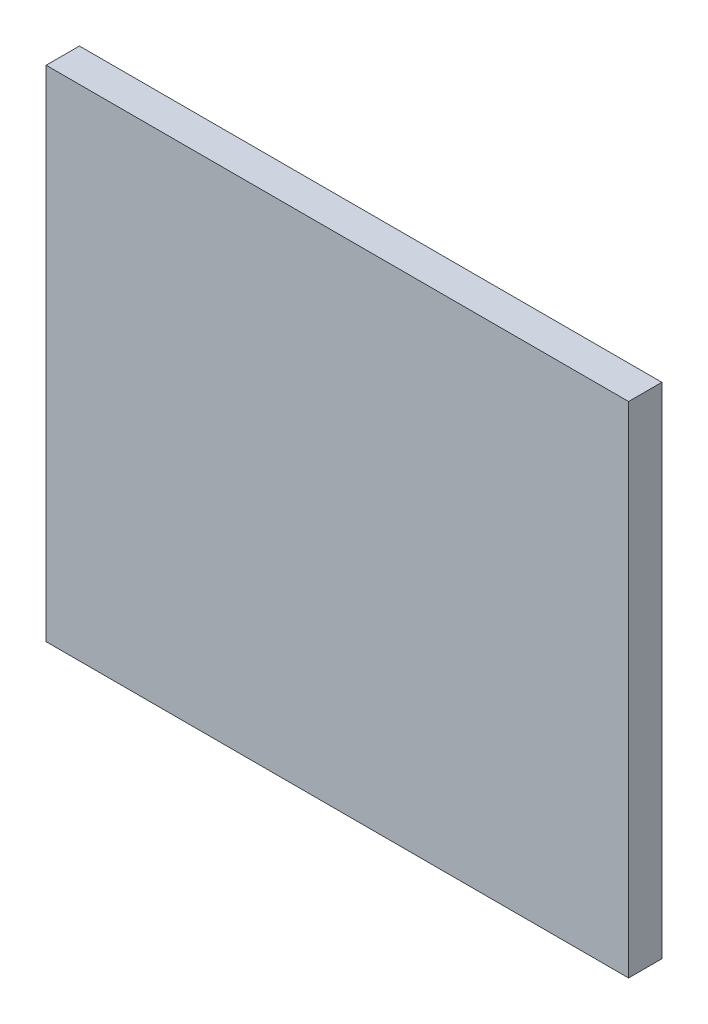
from build123d import *

# Parameters (mm, degrees)
SKETCH1_W     = 70
SKETCH1_H     = 60
PROFILE_DEPTH = 4


with BuildPart() as part:
    # Sketch1 → Profile (new body)
    with BuildSketch(Plane.XY):
        with Locations((35, 30)):
            Rectangle(SKETCH1_W, SKETCH1_H)
    extrude(amount=PROFILE_DEPTH)


solid = part.part
